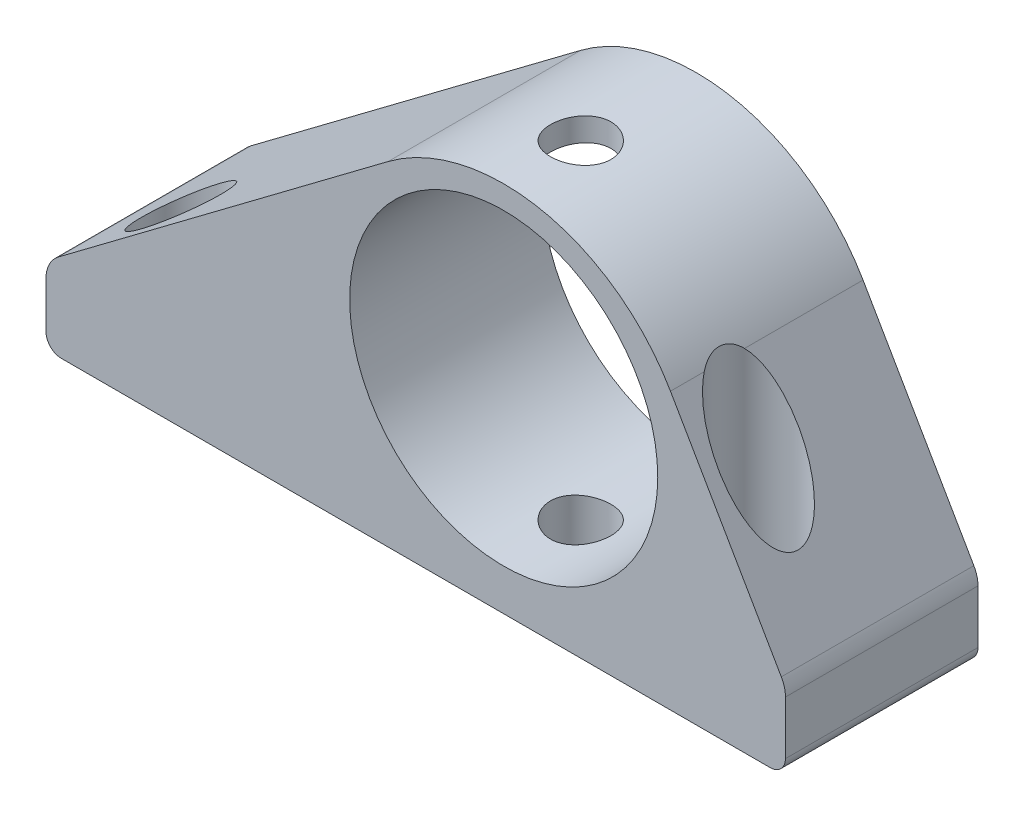
from build123d import *

# Parameters (mm, degrees)
SALIENTE_EXTRUIR1_DEPTH = 15.875
REDONDEO1_R             = 15.875
CORTAR_EXTRUIR1_REACH   = 48.084
CROQUIS2_R              = 9.525
CROQUIS3_R              = 12.7
CORTAR_EXTRUIR2_DEPTH   = 47.084243503
CROQUIS4_R              = 3.2639
CROQUIS4_R_2            = 2.4892
CORTAR_EXTRUIR3_DEPTH   = 47.084243503
REDONDEO2_R             = 2.54
REDONDEO3_R             = 1.27


with BuildPart() as part:
    # Croquis1 → Saliente-Extruir1 (new body)
    with BuildSketch(Plane.XY):
        Polygon((30.48, 0), (-30.48, 0), (-30.48, 6.35), (12.046472996, 38.277805334), (30.48, 6.35), align=None)
    extrude(amount=SALIENTE_EXTRUIR1_DEPTH)

    # Redondeo1
    redondeo1_edges = [part.edges().sort_by_distance(p)[0] for p in [
        (12.046472996, 38.277805334, 7.9375),
    ]]
    fillet(redondeo1_edges, radius=REDONDEO1_R)

    # Croquis2 → Cortar-Extruir1 (cut, up to next)
    with BuildSketch(Plane.XY.offset(15.875), mode=Mode.PRIVATE) as cortar_extruir1_sk1:
        with Locations((7.254003, 16.09860686)):
            Circle(CROQUIS2_R)
    cortar_extruir1_tool1 = extrude(cortar_extruir1_sk1.sketch, amount=-CORTAR_EXTRUIR1_REACH, mode=Mode.PRIVATE) & part.part
    add(cortar_extruir1_tool1.solids().sort_by_distance((7.254003, 16.098607, 15.875))[0], mode=Mode.SUBTRACT)

    # Croquis3 → Cortar-Extruir2 (cut, through all)
    with BuildSketch(Plane.XY.offset(15.875)):
        with Locations((7.254003, 16.09860686)):
            Circle(CROQUIS3_R)
    extrude(amount=-CORTAR_EXTRUIR2_DEPTH, mode=Mode.SUBTRACT)

    # Croquis4 → Cortar-Extruir3 (cut, through all)
    with BuildSketch(Plane.XZ):
        with Locations((-23.8125, 11.43)):
            Circle(CROQUIS4_R)
        with Locations(Location((23.8125, 11.43, 0), (0, 0, 210.56660833))):
            Circle(CROQUIS4_R)
        with Locations((7.254003, 9.525)):
            Circle(CROQUIS4_R_2)
    extrude(amount=-CORTAR_EXTRUIR3_DEPTH, mode=Mode.SUBTRACT)

    # Redondeo2
    redondeo2_edges = [part.edges().sort_by_distance(p)[0] for p in [
        (-30.48, 6.35, 7.9375),
        (30.48, 6.35, 7.9375),
    ]]
    fillet(redondeo2_edges, radius=REDONDEO2_R)

    # Redondeo3
    redondeo3_edges = [part.edges().sort_by_distance(p)[0] for p in [
        (30.48, 0, 7.9375),
        (-30.48, 0, 7.9375),
    ]]
    fillet(redondeo3_edges, radius=REDONDEO3_R)


solid = part.part
